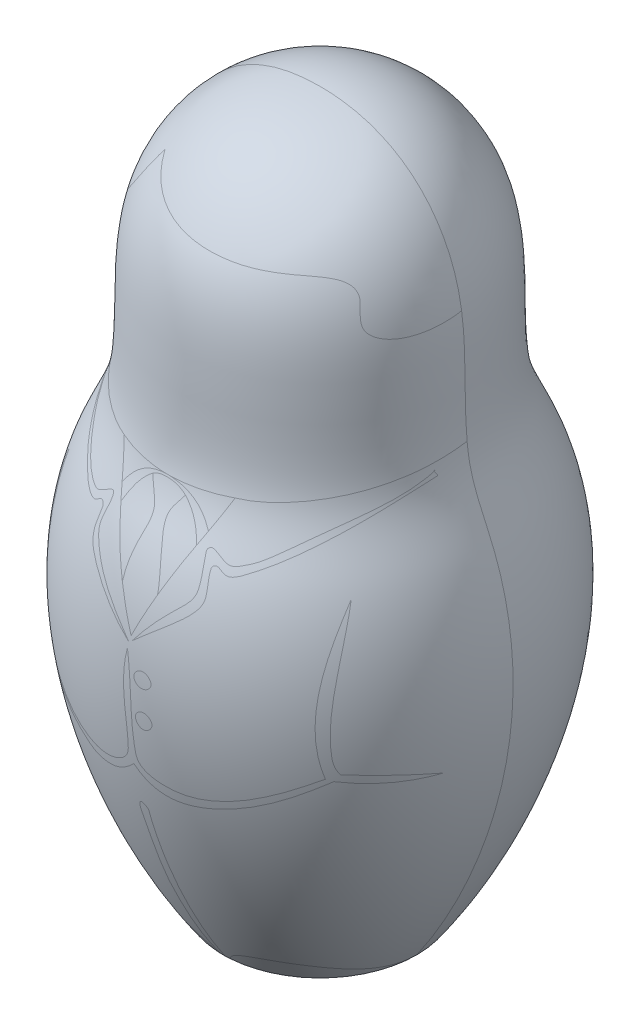
from build123d import *


with BuildPart() as part:
    # Esquisse1 → Révolution1 (revolve)
    with BuildSketch(Plane.XY):
        with BuildLine():
            Line((0, 0), (0, 471.5))
            add(Edge.make_bspline(
                [(-63.75, 8), (-110.621211702, 75.096965294), (-153.297628549, 197.196051015), (-99.027040788, 296.116333146), (-93.874616807, 343.134447618), (-100.840823599, 417.716975457), (-51.498801835, 471.5), (0, 471.5)],
                knots=[0, 0, 0, 0, 0.516513029, 0.585576677, 0.634733365, 0.784867327, 1, 1, 1, 1], degree=3))
            add(Edge.make_bspline(
                [(0, 0), (-21.727082726, 0), (-42.965367291, 1.294902553), (-63.75, 8)],
                knots=[0, 0, 0, 0, 1, 1, 1, 1], degree=3))
        make_face()
    revolve(axis=Axis((0, 0, 0), (0, 1, 0)))


solid = part.part
